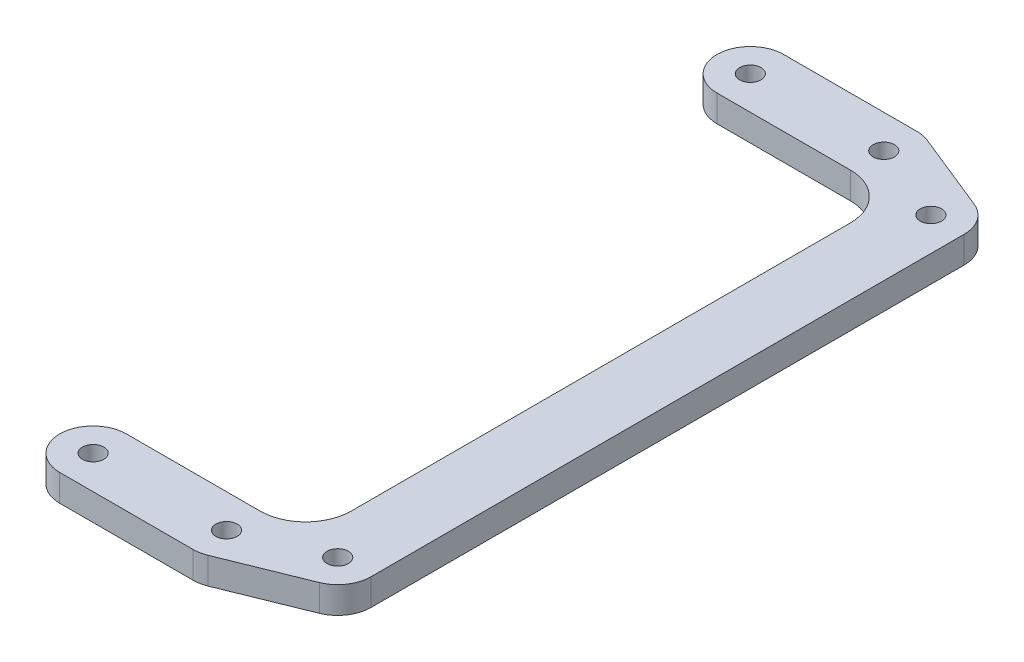
from build123d import *

# Parameters (mm, degrees)
SKETCH1_R           = 1.6
BOSS_EXTRUDE1_DEPTH = 4


with BuildPart() as part:
    # Sketch1 → Boss-Extrude1 (new body)
    # profile 1 of 5: a face of its own
    with BuildSketch(Plane(origin=(0, 0, 0), x_dir=(1, 0, 0), z_dir=(0, 1, 0))):
        with BuildLine():
            Line((-20, 44.25), (0, 44.25))
            ThreePointArc((0, 44.25), (5, 49.25), (0, 54.25))
            Line((0, 54.25), (-20, 54.25))
            ThreePointArc((-20, 54.25), (-25, 49.25), (-20, 44.25))
        make_face()
        with Locations(Location((0, 49.25, 0), (0, 0, 270))):
            Circle(SKETCH1_R, mode=Mode.SUBTRACT)
        with Locations(Location((-20, 49.25, 0), (0, 0, 270))):
            Circle(SKETCH1_R, mode=Mode.SUBTRACT)
    # profile 2 of 5: a face of its own
    with BuildSketch(Plane(origin=(0, 0, 0), x_dir=(1, 0, 0), z_dir=(0, 1, 0))):
        with BuildLine():
            Line((13.735803892, 49.084798783), (1.875803892, 53.884798783))
            ThreePointArc((1.875803892, 53.884798783), (4.907850544, 48.294488073), (0, 44.25))
            ThreePointArc((0, 44.25), (4.850752519, 42.240752519), (6.86, 37.39))
            Line((6.86, 37.39), (6.86, 44.45))
            ThreePointArc((6.86, 44.45), (9.065274563, 48.596023363), (13.735803892, 49.084798783))
        make_face()
    # profile 3 of 5: a face of its own
    with BuildSketch(Plane(origin=(0, 0, 0), x_dir=(1, 0, 0), z_dir=(0, 1, 0))):
        with BuildLine():
            ThreePointArc((6.86, -44.45), (11.86, -49.45), (16.86, -44.45))
            Line((16.86, -44.45), (16.86, 44.45))
            ThreePointArc((16.86, 44.45), (11.86, 49.45), (6.86, 44.45))
            Line((6.86, 44.45), (6.86, -44.45))
        make_face()
        with Locations(Location((11.86, -44.45, 0), (0, 0, 270))):
            Circle(SKETCH1_R, mode=Mode.SUBTRACT)
        with Locations(Location((11.86, 44.45, 0), (0, 0, 270))):
            Circle(SKETCH1_R, mode=Mode.SUBTRACT)
    # profile 4 of 5: a face of its own
    with BuildSketch(Plane(origin=(0, 0, 0), x_dir=(1, 0, 0), z_dir=(0, 1, 0))):
        with BuildLine():
            ThreePointArc((0, -44.25), (5, -49.25), (0, -54.25))
            Line((0, -54.25), (-20, -54.25))
            ThreePointArc((-20, -54.25), (-25, -49.25), (-20, -44.25))
            Line((-20, -44.25), (0, -44.25))
        make_face()
        with Locations(Location((-20, -49.25, 0), (0, 0, 270))):
            Circle(SKETCH1_R, mode=Mode.SUBTRACT)
        with Locations(Location((0, -49.25, 0), (0, 0, 270))):
            Circle(SKETCH1_R, mode=Mode.SUBTRACT)
    # profile 5 of 5: a face of its own
    with BuildSketch(Plane(origin=(0, 0, 0), x_dir=(1, 0, 0), z_dir=(0, 1, 0))):
        with BuildLine():
            Line((6.86, -44.45), (6.86, -37.39))
            ThreePointArc((6.86, -37.39), (4.850752519, -42.240752519), (0, -44.25))
            ThreePointArc((0, -44.25), (4.907850544, -48.294488073), (1.875803892, -53.884798783))
            Line((1.875803892, -53.884798783), (13.735803892, -49.084798783))
            ThreePointArc((13.735803892, -49.084798783), (9.065274563, -48.596023363), (6.86, -44.45))
        make_face()
    extrude(amount=BOSS_EXTRUDE1_DEPTH)


solid = part.part
